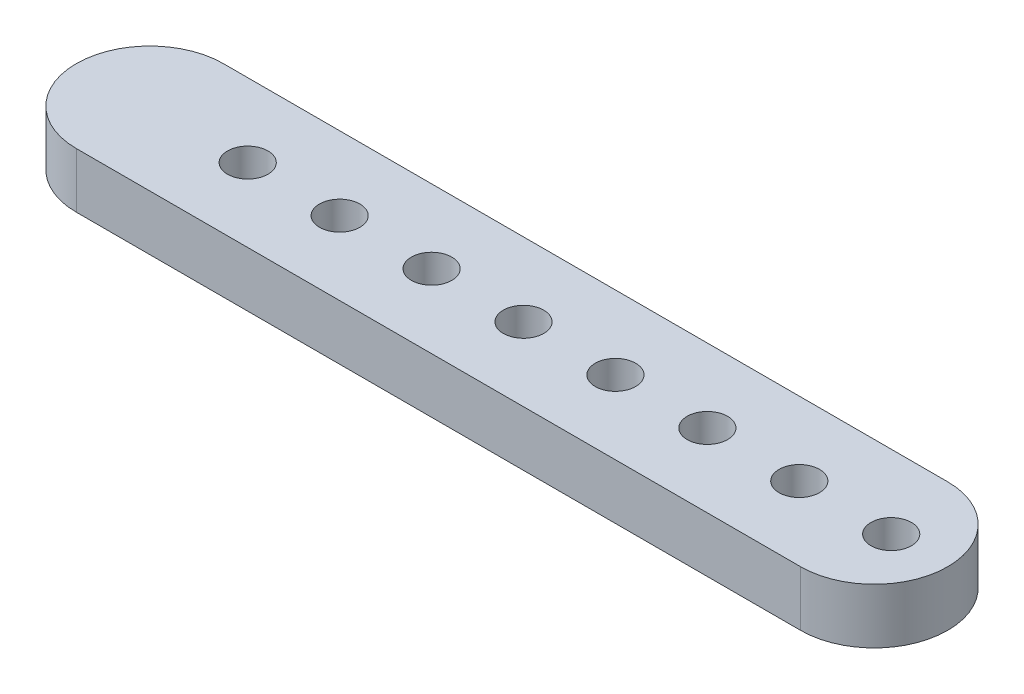
from build123d import *

# Parameters (mm, degrees)
BOSS_EXTRUDE1_DEPTH = 1.5
SKETCH2_R           = 0.55
CUT_EXTRUDE1_DEPTH  = 1.5
SCALE1_SCALE        = 2.5


with BuildPart() as part:
    # Sketch1 → Boss-Extrude1 (new body)
    with BuildSketch(Plane(origin=(0, 0, 0), x_dir=(1, 0, 0), z_dir=(0, 1, 0))):
        with BuildLine():
            Line((58.878887557, 2), (78.578887557, 2))
            ThreePointArc((78.578887557, 2), (80.578887557, 0), (78.578887557, -2))
            Line((78.578887557, -2), (58.878887557, -2))
            ThreePointArc((58.878887557, -2), (56.878887557, 0), (58.878887557, 2))
        make_face()
    extrude(amount=BOSS_EXTRUDE1_DEPTH)

    # Sketch2 → Cut-Extrude1 (cut)
    with BuildSketch(Plane(origin=(0, 1.5, 0), x_dir=(1, 0, 0), z_dir=(0, 1, 0))):
        with Locations(Location((79.041953668, 0, 0), (0, 0, 270))):
            Circle(SKETCH2_R)
        with Locations(Location((76.541953668, 0, 0), (0, 0, 270))):
            Circle(SKETCH2_R)
        with Locations(Location((74.041953668, 0, 0), (0, 0, 270))):
            Circle(SKETCH2_R)
        with Locations(Location((71.541953668, 0, 0), (0, 0, 270))):
            Circle(SKETCH2_R)
        with Locations(Location((69.041953668, 0, 0), (0, 0, 270))):
            Circle(SKETCH2_R)
        with Locations(Location((66.541953668, 0, 0), (0, 0, 270))):
            Circle(SKETCH2_R)
        with Locations(Location((64.041953668, 0, 0), (0, 0, 270))):
            Circle(SKETCH2_R)
        with Locations(Location((61.541953668, 0, 0), (0, 0, 270))):
            Circle(SKETCH2_R)
    extrude(amount=-CUT_EXTRUDE1_DEPTH, mode=Mode.SUBTRACT)


with BuildPart() as part_1:
    # Scale1: scaled about (68.587018838, 0.75, 0)
    add(part.part.scale(SCALE1_SCALE).moved(Location((-102.880528257, -1.125, 0))))


solid = part_1.part
